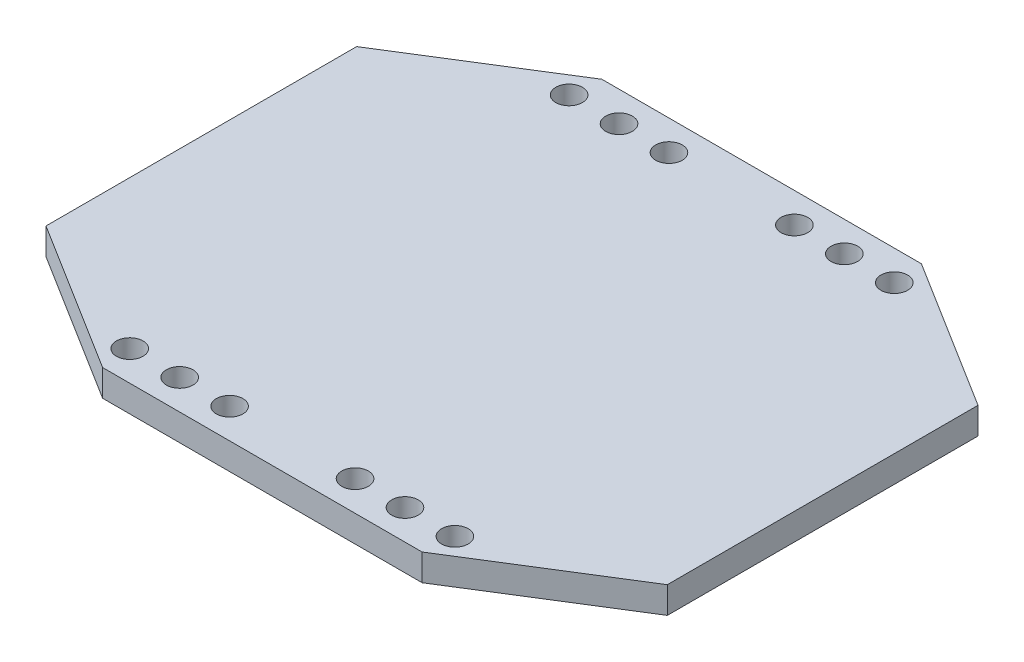
from build123d import *

# Parameters (mm, degrees)
BOSS_EXTRUDE1_DEPTH     = 1.2
SKETCH3_R               = 1.2
CUT_EXTRUDE1_DEPTH      = 37.000138889
MIRROR2_COPY_1_SKETCH_R = 1.2
MIRROR2_COPY_1_DEPTH    = 37.000138889


with BuildPart() as part:
    # Sketch2 → Boss-Extrude1 (new, symmetric)
    with BuildSketch(Plane(origin=(0, 0, 0), x_dir=(1, 0, 0), z_dir=(0, 1, 0))):
        Polygon((-28, -14), (-28, 14), (-14.397156503, 22.5), (14.397156503, 22.5), (28, 14), (28, -14), (14.397156503, -22.5), (-14.397156503, -22.5), align=None)
    extrude(amount=BOSS_EXTRUDE1_DEPTH, both=True)

    # Sketch3 → Cut-Extrude1 (cut, through all)
    with BuildSketch(Plane(origin=(0, 1.2, 0), x_dir=(1, 0, 0), z_dir=(0, 1, 0))):
        with Locations(Location((-14.653288443, 19.8, 0), (0, 0, 270))):
            Circle(SKETCH3_R)
        with Locations(Location((-10.153288443, 19.8, 0), (0, 0, 270))):
            Circle(SKETCH3_R)
        with Locations(Location((-5.653288443, 19.8, 0), (0, 0, 270))):
            Circle(SKETCH3_R)
    cut_extrude1 = extrude(amount=-CUT_EXTRUDE1_DEPTH, mode=Mode.SUBTRACT)

    # Mirror1: Cut-Extrude1 across plane
    add(cut_extrude1.mirror(Plane(origin=(0, 0, 0), x_dir=(0, 0, 1), z_dir=(1, 0, 0))), mode=Mode.SUBTRACT)

    # Mirror2: Cut-Extrude1 across plane
    add(cut_extrude1.mirror(Plane.XY), mode=Mode.SUBTRACT)

    # Mirror2 copy 1 sketch → Mirror2 copy 1 (cut, through all)
    with BuildSketch(Plane(origin=(0, 1.2, 0), x_dir=(-1, 0, 0), z_dir=(0, 1, 0))):
        with Locations(Location((-14.653288443, 19.8, 0), (0, 0, 270))):
            Circle(MIRROR2_COPY_1_SKETCH_R)
        with Locations(Location((-10.153288443, 19.8, 0), (0, 0, 270))):
            Circle(MIRROR2_COPY_1_SKETCH_R)
        with Locations(Location((-5.653288443, 19.8, 0), (0, 0, 270))):
            Circle(MIRROR2_COPY_1_SKETCH_R)
    extrude(amount=-MIRROR2_COPY_1_DEPTH, mode=Mode.SUBTRACT)


solid = part.part
